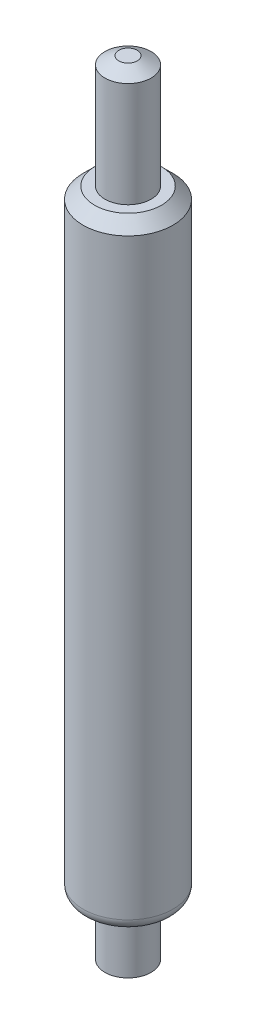
from build123d import *

# Parameters (mm, degrees)
CHAMFER1_SIZE  = 0.06
CHAMFER1_SIZE2 = 0.034641016
CHAMFER2_SIZE  = 0.06
CHAMFER2_SIZE2 = 0.034641016
CHAMFER3_SIZE  = 0.05
FILLET1_R      = 0.05


with BuildPart() as part:
    # Sketch1 → Revolve1 (revolve)
    with BuildSketch(Plane.XY, mode=Mode.PRIVATE) as revolve1_sk:
        Polygon((0, 1.715), (0.1, 1.715), (0.1, 1.225), (0.195, 1.225), (0.195, -1.445), (0.1, -1.445), (0.1, -1.715), (0, -1.715), align=None)
    revolve(revolve1_sk.sketch.rotate(Axis((0, -1.057499082, 0), (0, 1, 0)), 90), axis=Axis((0, -1.057499082, 0), (0, 1, 0)))

    # Chamfer1
    chamfer1_edges = [part.edges().sort_by_distance(p)[0] for p in [
        (0, 1.715, 0.1),
    ]]
    chamfer1_side = [part.faces().sort_by_distance(p)[0] for p in [
        (0, 1.715, 0),
    ]]
    chamfer(chamfer1_edges, length=CHAMFER1_SIZE, length2=CHAMFER1_SIZE2, reference=chamfer1_side[0])

    # Chamfer2
    chamfer2_edges = [part.edges().sort_by_distance(p)[0] for p in [
        (0, -1.715, 0.1),
    ]]
    chamfer2_side = [part.faces().sort_by_distance(p)[0] for p in [
        (0, -1.715, 0),
    ]]
    chamfer(chamfer2_edges, length=CHAMFER2_SIZE, length2=CHAMFER2_SIZE2, reference=chamfer2_side[0])

    # Chamfer3
    chamfer3_edges = [part.edges().sort_by_distance(p)[0] for p in [
        (0, 1.225, 0.195),
    ]]
    chamfer(chamfer3_edges, length=CHAMFER3_SIZE)

    # Fillet1
    fillet1_edges = [part.edges().sort_by_distance(p)[0] for p in [
        (0, -1.445, 0.195),
    ]]
    fillet(fillet1_edges, radius=FILLET1_R)


solid = part.part
